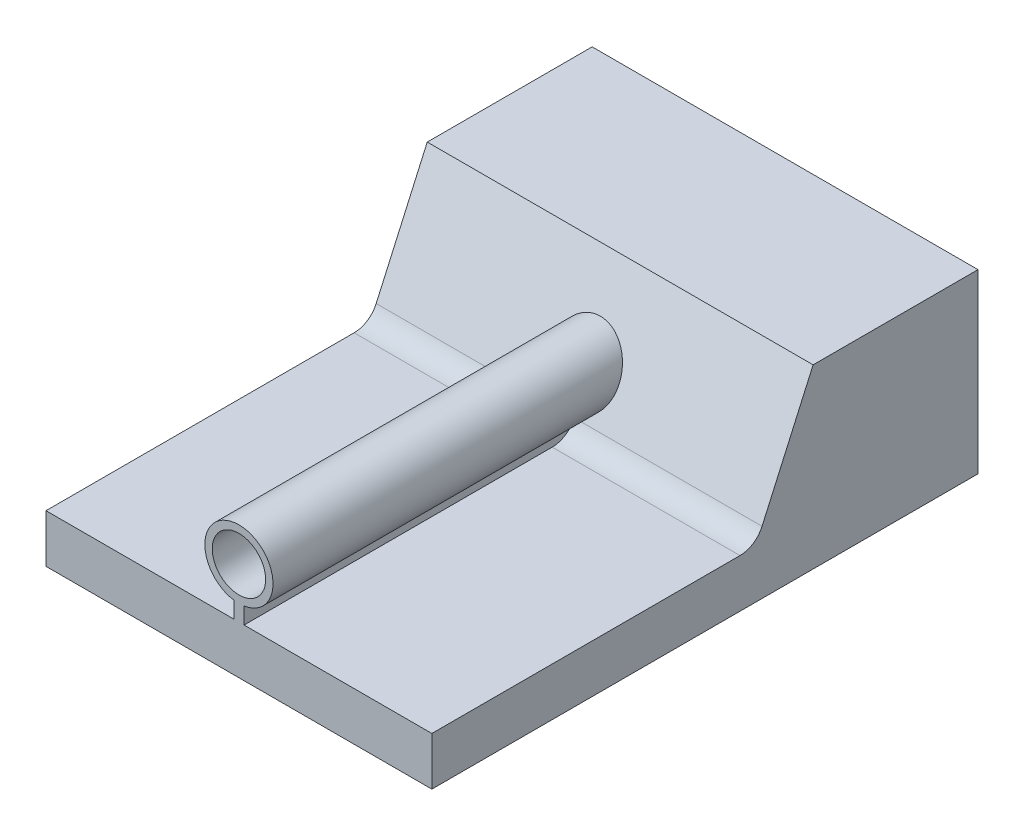
from build123d import *

# Parameters (mm, degrees)
EXTRUDE7_DEPTH = 76.2
EXTRUDE8_REACH = 138.595
SKETCH17_R     = 5.268795673
FILLET1_R      = 4.7752


with BuildPart() as part:
    # Sketch16 → Extrude7 (new body)
    with BuildSketch(Plane(origin=(0, 0, 0), x_dir=(0, 0, -1), z_dir=(1, 0, 0))):
        Polygon((0, 0), (107.851907976, 0), (107.851907976, 34.925), (75.287725604, 34.925), (63.942784648, 9.525), (0, 9.525), align=None)
    extrude(amount=EXTRUDE7_DEPTH)

    # Extrude8: up to this plane
    extrude8_end = Plane(origin=(76.2, 34.925, -75.287725604), z_dir=(0, -0.4078203414676676, -0.9130621934376623))
    # Sketch17 → Extrude8 (add, up to the surface)
    with BuildSketch(Plane.XY, mode=Mode.PRIVATE) as extrude8_sk1:
        with BuildLine():
            Line((39.116, 9.525), (37.084, 9.525))
            Line((37.084, 9.525), (37.084, 12.7))
            Line((37.084, 12.7), (37.084, 12.777118098))
            ThreePointArc((37.084, 12.777118098), (38.1, 26.162510517), (39.116, 12.777118098))
            Line((39.116, 12.777118098), (39.116, 12.7))
            Line((39.116, 12.7), (39.116, 9.525))
        make_face()
        with Locations((38.1, 19.431255259)):
            Circle(SKETCH17_R, mode=Mode.SUBTRACT)
    extrude8_tool1 = split(extrude(extrude8_sk1.sketch, amount=-EXTRUDE8_REACH, mode=Mode.PRIVATE), bisect_by=extrude8_end, keep=Keep.BOTH, mode=Mode.PRIVATE)
    add(extrude8_tool1.solids().sort_by_distance((38.1, 9.73902, 0))[0])

    # Fillet1
    fillet1_edges = [part.edges().sort_by_distance(p)[0] for p in [
        (57.658, 9.525, -63.942784648),
        (18.542, 9.525, -63.942784648),
    ]]
    fillet(fillet1_edges, radius=FILLET1_R)


solid = part.part
